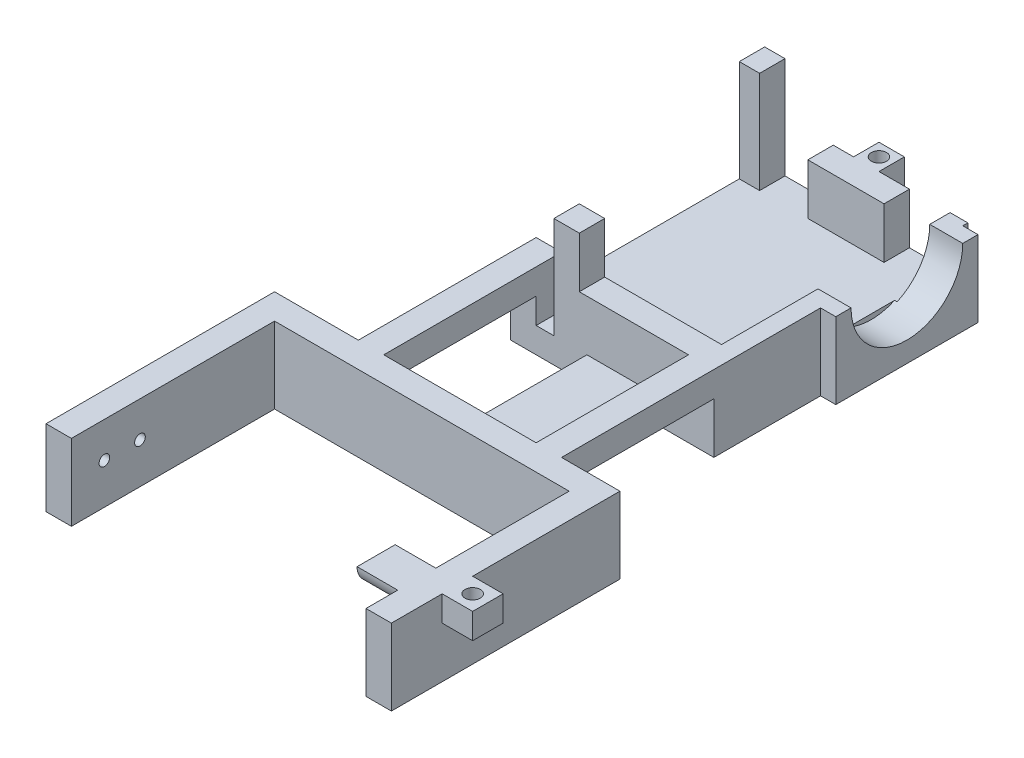
from build123d import *

# Parameters (mm, degrees)
SKETCH1_W            = 40
SKETCH1_H            = 50
BOSS_EXTRUDE1_DEPTH  = 5
SKETCH4_W            = 5
SKETCH4_H            = 5
SKETCH4_W_2          = 4
BOSS_EXTRUDE4_DEPTH  = 20
SKETCH4_4_W          = 5
SKETCH4_4_H          = 5
SKETCH4_4_W_2        = 15
BOSS_EXTRUDE5_DEPTH  = 10
CUT_EXTRUDE2_DEPTH   = 4
BOSS_EXTRUDE7_START  = 3
BOSS_EXTRUDE7_DEPTH  = 3
SKETCH10_W           = 5
SKETCH10_H           = 5
BOSS_EXTRUDE9_DEPTH  = 5
SKETCH11_R           = 1.5
CUT_EXTRUDE3_DEPTH   = 5
SKETCH12_W           = 5
SKETCH12_H           = 5
SKETCH12_W_2         = 10
BOSS_EXTRUDE10_DEPTH = 30
SKETCH13_W           = 40
SKETCH13_H           = 15
BOSS_EXTRUDE11_DEPTH = 5
SKETCH14_W           = 5
SKETCH14_H           = 15
BOSS_EXTRUDE12_DEPTH = 11.5
SKETCH15_W           = 5
SKETCH15_H           = 15
BOSS_EXTRUDE13_DEPTH = 16.5
SKETCH16_W           = 5
SKETCH16_H           = 15
BOSS_EXTRUDE14_DEPTH = 40
BOSS_EXTRUDE15_DEPTH = 8
SKETCH20_W           = 6
SKETCH20_H           = 5
BOSS_EXTRUDE17_DEPTH = 6
SKETCH21_R           = 1.5
CUT_EXTRUDE5_DEPTH   = 5
SKETCH24_R           = 1.05
CUT_EXTRUDE6_DEPTH   = 5


with BuildPart() as part:
    # Sketch1 → Boss-Extrude1 (new body)
    with BuildSketch(Plane(origin=(0, 0, 0), x_dir=(1, 0, 0), z_dir=(0, 1, 0))):
        Rectangle(SKETCH1_W, SKETCH1_H)
    extrude(amount=BOSS_EXTRUDE1_DEPTH)

    # Sketch4 → Boss-Extrude4 (add)
    with BuildSketch(Plane(origin=(0, 5, 0), x_dir=(1, 0, 0), z_dir=(0, 1, 0))):
        with Locations((-9, -22.5)):
            Rectangle(SKETCH4_W, SKETCH4_H)
        with Locations((-18, 22.5)):
            Rectangle(SKETCH4_W_2, SKETCH4_H)
    extrude(amount=BOSS_EXTRUDE4_DEPTH)

    # Sketch4<4> → Boss-Extrude5 (add)
    with BuildSketch(Plane(origin=(0, 5, 0), x_dir=(1, 0, 0), z_dir=(0, 1, 0))):
        Polygon((20, -25), (20, 25), (16.5, 25), (16.5, -20), (-6.5, -20), (-6.5, -25), align=None)
        with Locations((-17.5, -22.5)):
            Rectangle(SKETCH4_4_W, SKETCH4_4_H)
        with Locations((1, 22.5)):
            Rectangle(SKETCH4_4_W_2, SKETCH4_4_H)
    extrude(amount=BOSS_EXTRUDE5_DEPTH)

    # Sketch7 → Cut-Extrude2 (cut)
    with BuildSketch(Plane(origin=(20, 0, 0), x_dir=(0, 0, -1), z_dir=(1, 0, 0))):
        with BuildLine():
            Line((-1, 15), (21, 15))
            ThreePointArc((21, 15), (10, 4), (-1, 15))
        make_face()
    extrude(amount=-CUT_EXTRUDE2_DEPTH, mode=Mode.SUBTRACT)

    # Sketch8 → Boss-Extrude7 (add)
    with BuildSketch(Plane(origin=(20, 0, 0), x_dir=(0, 0, -1), z_dir=(1, 0, 0)).offset(BOSS_EXTRUDE7_START)):
        with BuildLine():
            Line((-1, 15), (-4, 15))
            Line((-4, 15), (-4, 0))
            Line((-4, 0), (24, 0))
            Line((24, 0), (24, 15))
            Line((24, 15), (21, 15))
            ThreePointArc((21, 15), (10, 4), (-1, 15))
        make_face()
    extrude(amount=-BOSS_EXTRUDE7_DEPTH)

    # Sketch10 → Boss-Extrude9 (add)
    with BuildSketch(Plane(origin=(0, 0, -25), x_dir=(-1, 0, 0), z_dir=(0, 0, -1))):
        with Locations((0, 12.5)):
            Rectangle(SKETCH10_W, SKETCH10_H)
    extrude(amount=BOSS_EXTRUDE9_DEPTH)

    # Sketch11 → Cut-Extrude3 (cut)
    with BuildSketch(Plane.XZ.offset(-10)):
        with Locations((0, -27.5)):
            Circle(SKETCH11_R)
    extrude(amount=-CUT_EXTRUDE3_DEPTH, mode=Mode.SUBTRACT)

    # Sketch12 → Boss-Extrude10 (add)
    with BuildSketch(Plane.XY.offset(25)):
        with Locations((-17.5, 12.5)):
            Rectangle(SKETCH12_W, SKETCH12_H)
        with Locations((17.5, 12.5)):
            Rectangle(SKETCH12_W, SKETCH12_H)
        with Locations((0, 2.5)):
            Rectangle(SKETCH12_W_2, SKETCH12_H)
    extrude(amount=BOSS_EXTRUDE10_DEPTH)

    # Sketch13 → Boss-Extrude11 (add)
    with BuildSketch(Plane.XY.offset(55)):
        with Locations((0, 7.5)):
            Rectangle(SKETCH13_W, SKETCH13_H)
    extrude(amount=BOSS_EXTRUDE11_DEPTH)

    # Sketch14 → Boss-Extrude12 (add)
    with BuildSketch(Plane(origin=(20, 0, 0), x_dir=(0, 0, -1), z_dir=(1, 0, 0))):
        with Locations((-57.5, 7.5)):
            Rectangle(SKETCH14_W, SKETCH14_H)
    extrude(amount=BOSS_EXTRUDE12_DEPTH)

    # Sketch15 → Boss-Extrude13 (add)
    with BuildSketch(Plane.ZY.offset(20)):
        with Locations((57.5, 7.5)):
            Rectangle(SKETCH15_W, SKETCH15_H)
    extrude(amount=BOSS_EXTRUDE13_DEPTH)

    # Sketch16 → Boss-Extrude14 (add)
    with BuildSketch(Plane.XY.offset(60)):
        with Locations((-34, 7.5)):
            Rectangle(SKETCH16_W, SKETCH16_H)
        with Locations((29, 7.5)):
            Rectangle(SKETCH16_W, SKETCH16_H)
    extrude(amount=BOSS_EXTRUDE14_DEPTH)

    # Sketch17 → Boss-Extrude15 (add)
    with BuildSketch(Plane.ZY.offset(-26.5)):
        with BuildLine():
            Line((86.25, 15), (93.75, 15))
            ThreePointArc((93.75, 15), (90, 11.25), (86.25, 15))
        make_face()
    extrude(amount=BOSS_EXTRUDE15_DEPTH)

    # Sketch20 → Boss-Extrude17 (add)
    with BuildSketch(Plane(origin=(31.5, 0, 0), x_dir=(0, 0, -1), z_dir=(1, 0, 0))):
        with Locations((-87, 12.5)):
            Rectangle(SKETCH20_W, SKETCH20_H)
    extrude(amount=BOSS_EXTRUDE17_DEPTH)

    # Sketch21 → Cut-Extrude5 (cut)
    with BuildSketch(Plane.XZ.offset(-10)):
        with Locations((34.5, 87)):
            Circle(SKETCH21_R)
    extrude(amount=-CUT_EXTRUDE5_DEPTH, mode=Mode.SUBTRACT)

    # Sketch24 → Cut-Extrude6 (cut)
    with BuildSketch(Plane(origin=(-31.5, 0, 0), x_dir=(0, 0, -1), z_dir=(1, 0, 0))):
        with Locations((-93.5, 8)):
            Circle(SKETCH24_R)
        with Locations((-86.5, 8)):
            Circle(SKETCH24_R)
    extrude(amount=-CUT_EXTRUDE6_DEPTH, mode=Mode.SUBTRACT)


solid = part.part
